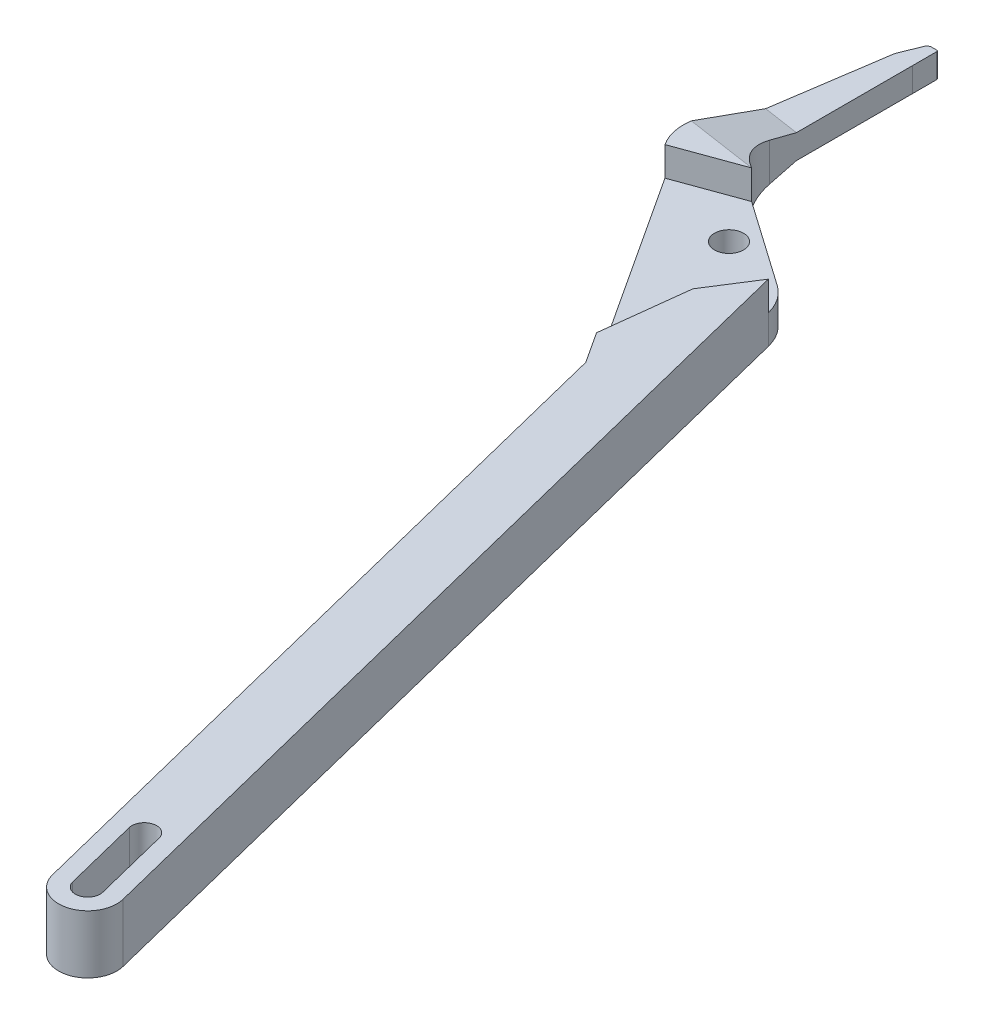
from build123d import *

# Parameters (mm, degrees)
SKETCH1_R           = 3
BOSS_EXTRUDE2_DEPTH = 12
SKETCH3_W           = 12.000133412
SKETCH3_H           = 3.5
CUT_EXTRUDE1_DEPTH  = 214.167200314
CUT_EXTRUDE4_DEPTH  = 6


with BuildPart() as part:
    # Sketch1 → Boss-Extrude2 (new body)
    # profile 1 of 5: a face of its own
    with BuildSketch(Plane(origin=(0, 0, 0), x_dir=(1, 0, 0), z_dir=(0, 1, 0))):
        with BuildLine():
            Line((-19.125338302, 7.287833106), (4.566615153, -9.301451298))
            Line((4.566615153, -9.301451298), (12.801336755, -42.329115693))
            Line((12.801336755, -42.329115693), (49.322165839, -188.806160659))
            ThreePointArc((49.322165839, -188.806160659), (49.451500057, -185.458284048), (51.355769549, -182.701698688))
            Line((51.355769549, -182.701698688), (48.798935765, -172.446798499))
            ThreePointArc((48.798935765, -172.446798499), (50.656289033, -169.355643563), (53.747443969, -171.212996831))
            Line((53.747443969, -171.212996831), (56.304277753, -181.467897021))
            ThreePointArc((56.304277753, -181.467897021), (59.279786353, -183.007817055), (60.965714554, -185.903097912))
            Line((60.965714554, -185.903097912), (16.76676248, -8.630783649))
            ThreePointArc((16.76676248, -8.630783649), (15.305067103, -5.385940236), (12.79956958, -2.858482162))
            Line((12.79956958, -2.858482162), (-5.735764364, 10.120098389))
            ThreePointArc((-5.735764364, 10.120098389), (-8.870108332, 13.694132699), (-10, 18.311618831))
            Line((-10, 18.311618831), (-10, 52.855948326))
            ThreePointArc((-10, 52.855948326), (-10.073223305, 53.032725021), (-10.25, 53.105948326))
            Line((-10.25, 53.105948326), (-11.322967039, 53.105948326))
            ThreePointArc((-11.322967039, 53.105948326), (-11.883595848, 52.934015556), (-12.251443729, 52.477339002))
            Line((-12.251443729, 52.477339002), (-13.870086592, 48.430731845))
            ThreePointArc((-13.870086592, 48.430731845), (-13.980381666, 48.100636263), (-14.05170411, 47.759988049))
            Line((-14.05170411, 47.759988049), (-19.445744306, 11.667622342))
            ThreePointArc((-19.445744306, 11.667622342), (-19.528933908, 9.459922198), (-19.125338302, 7.287833106))
        make_face()
        with Locations(Location((0, 0, 0), (0, 0, 270))):
            Circle(SKETCH1_R, mode=Mode.SUBTRACT)
    # profile 2 of 5: a face of its own
    with BuildSketch(Plane(origin=(0, 0, 0), x_dir=(1, 0, 0), z_dir=(0, 1, 0))):
        with BuildLine():
            ThreePointArc((51.355769549, -182.701698688), (49.451500057, -185.458284048), (49.322165839, -188.806160659))
            Line((49.322165839, -188.806160659), (52.669686095, -187.971530119))
            Line((52.669686095, -187.971530119), (51.355769549, -182.701698688))
        make_face()
    # profile 3 of 5: a face of its own
    with BuildSketch(Plane(origin=(0, 0, 0), x_dir=(1, 0, 0), z_dir=(0, 1, 0))):
        with BuildLine():
            Line((56.304277753, -181.467897021), (57.618194299, -186.737728452))
            Line((57.618194299, -186.737728452), (60.965714554, -185.903097912))
            ThreePointArc((60.965714554, -185.903097912), (59.279786353, -183.007817055), (56.304277753, -181.467897021))
        make_face()
    # profile 4 of 5: a face of its own
    with BuildSketch(Plane(origin=(0, 0, 0), x_dir=(1, 0, 0), z_dir=(0, 1, 0))):
        with BuildLine():
            Line((52.669686095, -187.971530119), (49.322165839, -188.806160659))
            ThreePointArc((49.322165839, -188.806160659), (55.875156257, -193.309906195), (61.143940197, -187.354629285))
            ThreePointArc((61.143940197, -187.354629285), (61.099217106, -186.623413225), (60.965714554, -185.903097912))
            Line((60.965714554, -185.903097912), (57.618194299, -186.737728452))
            ThreePointArc((57.618194299, -186.737728452), (55.76084103, -189.828883387), (52.669686095, -187.971530119))
        make_face()
    # profile 5 of 5: a face of its own
    with BuildSketch(Plane(origin=(0, 0, 0), x_dir=(1, 0, 0), z_dir=(0, 1, 0))):
        with BuildLine():
            Line((12.801336755, -42.329115693), (4.566615153, -9.301451298))
            Line((4.566615153, -9.301451298), (-19.125338302, 7.287833106))
            ThreePointArc((-19.125338302, 7.287833106), (-18.618024546, 5.961975552), (-17.928078586, 4.721314409))
            Line((-17.928078586, 4.721314409), (12.801336755, -42.329115693))
        make_face()
    extrude(amount=BOSS_EXTRUDE2_DEPTH)

    # Sketch3 → Cut-Extrude1 (cut, through all)
    with BuildSketch(Plane(origin=(-20.726542351, 0, -3.097602509), x_dir=(-0.14780941112960405, 0, 0.9890158633619178), z_dir=(-0.9890158633619179, 0, -0.14780941112960405))):
        Polygon((-45.158411705, 0), (-8.665199569, 0), (-22.158545117, 3.5), (-45.158411705, 3.5), align=None)
        Polygon((-22.158545117, 8.5), (-8.665199569, 12), (-45.158411705, 12), (-45.158411705, 8.5), align=None)
        with Locations((-51.158478411, 10.25)):
            Rectangle(SKETCH3_W, SKETCH3_H)
        with Locations((-51.158478411, 1.75)):
            Rectangle(SKETCH3_W, SKETCH3_H)
    extrude(amount=-CUT_EXTRUDE1_DEPTH, mode=Mode.SUBTRACT)

    # Sketch4 → Cut-Extrude4 (cut)
    with BuildSketch(Plane(origin=(0, 12, 0), x_dir=(1, 0, 0), z_dir=(0, 1, 0))):
        Polygon((-4.825296228, 9.482581737), (-17.928078586, 4.721314409), (8.620757021, -35.928145405), (10.712004266, -18.156650248), (16.76676248, -8.630783649), (17.432158169, -2.976226879), align=None)
    extrude(amount=-CUT_EXTRUDE4_DEPTH, mode=Mode.SUBTRACT)


solid = part.part
